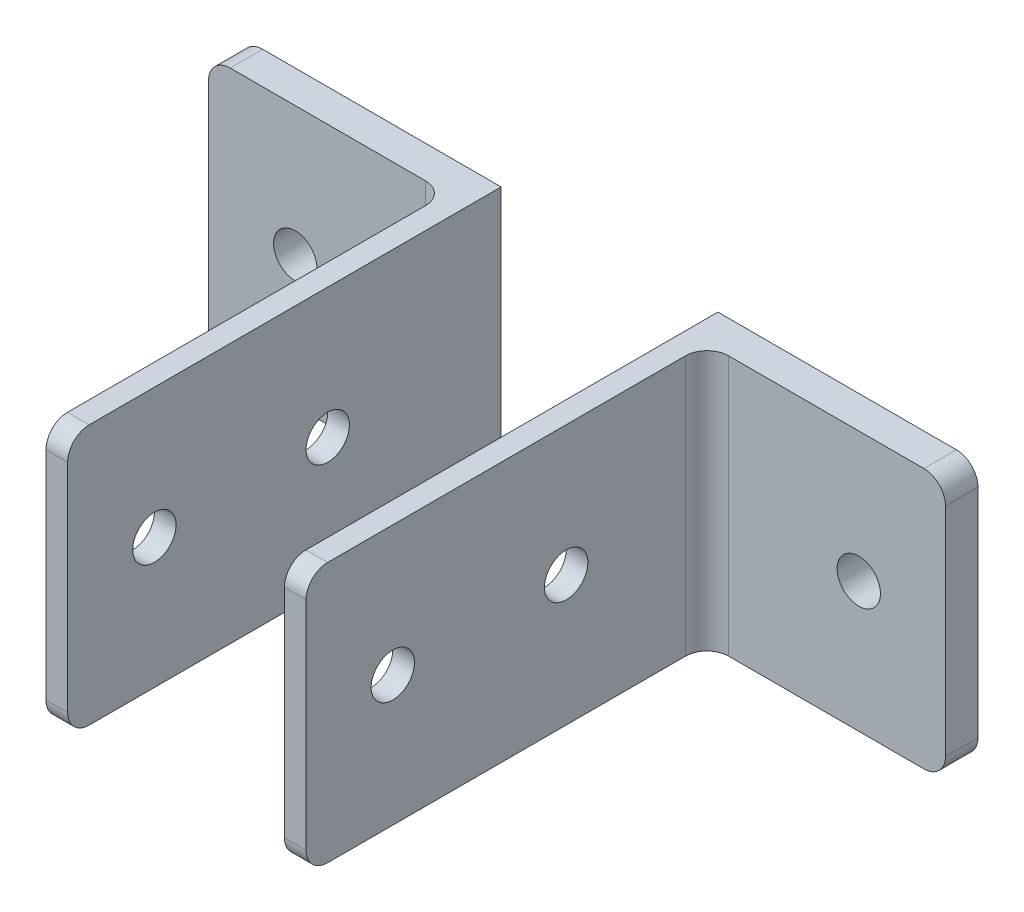
from build123d import *

# Parameters (mm, degrees)
BOSS_EXTRUDE2_DEPTH   = 19.05
BOSS_EXTRUDE2_2_DEPTH = 19.05
SKETCH2_R             = 3.175
EXTRUDE2_DEPTH        = 86.489491313
EXTRUDE3_DEPTH        = 86.988181903
EXTRUDE3_DEPTH_BACK   = 86.988181903
SKETCH3_R             = 3.175
FILLET3_R             = 3.1623
FILLET4_R             = 3.1623


with BuildPart() as part:
    # Sketch1 → Boss-Extrude2 (new, symmetric)
    with BuildSketch(Plane(origin=(0, 0, 0), x_dir=(1, 0, 0), z_dir=(0, 1, 0))):
        Polygon((-53.975, 0), (-15.875, 0), (-15.875, -63.5), (-19.05, -63.5), (-19.05, -4.7625), (-53.975, -4.7625), align=None)
    extrude(amount=BOSS_EXTRUDE2_DEPTH, both=True)


with BuildPart() as body_2:
    # Sketch1 → Boss-Extrude2 2 (new, symmetric)
    with BuildSketch(Plane(origin=(0, 0, 0), x_dir=(1, 0, 0), z_dir=(0, 1, 0))):
        Polygon((53.975, 0), (53.975, -4.7625), (19.05, -4.7625), (19.05, -63.5), (15.875, -63.5), (15.875, 0), align=None)
    extrude(amount=BOSS_EXTRUDE2_2_DEPTH, both=True)


with BuildPart() as extrude2_tool:
    # Sketch2 → Extrude2 (new, through all)
    with BuildSketch(Plane.XY):
        with Locations(Location((-41.275, 0, 0), (0, 0, 180))):
            Circle(SKETCH2_R)
        with Locations(Location((41.275, 0, 0), (0, 0, 180))):
            Circle(SKETCH2_R)
    extrude(amount=EXTRUDE2_DEPTH)


with BuildPart() as part_1:
    add(part.part)

    # Extrude2: cut by extrude2_tool
    add(extrude2_tool.part, mode=Mode.SUBTRACT)


with BuildPart() as body_2_1:
    add(body_2.part)

    # Extrude2: cut by extrude2_tool
    add(extrude2_tool.part, mode=Mode.SUBTRACT)


with BuildPart() as extrude3_tool:
    # Sketch3 → Extrude3 (new, two sides: drawn at the far end of the back side and taken through both)
    with BuildSketch(Plane(origin=(0, 0, -0.669808337), x_dir=(0, 0, -1), z_dir=(1, 0, 0)).offset(-EXTRUDE3_DEPTH_BACK)):
        with Locations(Location((-51.469808337, 0, 0), (0, 0, 180))):
            Circle(SKETCH3_R)
        with Locations(Location((-26.069808337, 0, 0), (0, 0, 180))):
            Circle(SKETCH3_R)
    extrude(amount=EXTRUDE3_DEPTH + EXTRUDE3_DEPTH_BACK)


with BuildPart() as part_2:
    add(part_1.part)

    # Extrude3: cut by extrude3_tool
    add(extrude3_tool.part, mode=Mode.SUBTRACT)

    # Fillet4
    fillet4_edges = [part_2.edges().sort_by_distance(p)[0] for p in [
        (-53.975, 19.05, 2.38125),
        (-19.05, 0, 4.7625),
        (-17.4625, 19.05, 63.5),
        (-17.4625, -19.05, 63.5),
        (-53.975, -19.05, 2.38125),
    ]]
    fillet(fillet4_edges, radius=FILLET4_R)


with BuildPart() as body_2_2:
    add(body_2_1.part)

    # Extrude3: cut by extrude3_tool
    add(extrude3_tool.part, mode=Mode.SUBTRACT)

    # Fillet3
    fillet3_edges = [body_2_2.edges().sort_by_distance(p)[0] for p in [
        (17.4625, 19.05, 63.5),
        (19.05, 0, 4.7625),
        (53.975, 19.05, 2.38125),
        (53.975, -19.05, 2.38125),
        (17.4625, -19.05, 63.5),
    ]]
    fillet(fillet3_edges, radius=FILLET3_R)


solid = Compound([part_2.part, body_2_2.part])
